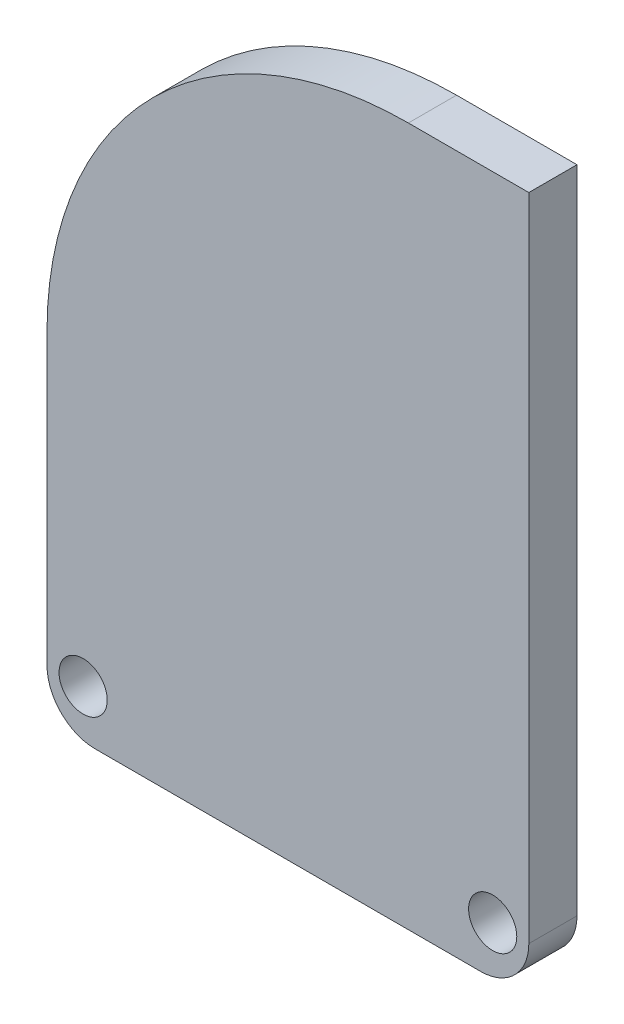
from build123d import *

# Parameters (mm, degrees)
SKETCH1_R           = 1
BOSS_EXTRUDE1_DEPTH = 2


with BuildPart() as part:
    # Sketch1 → Boss-Extrude1 (new body)
    with BuildSketch(Plane.XY):
        with BuildLine():
            Line((0, 0), (-5, 0))
            ThreePointArc((-5, 0), (-15.606601718, -4.393398282), (-20, -15))
            Line((-20, -15), (-20, -27))
            ThreePointArc((-20, -27), (-19.414213562, -28.414213562), (-18, -29))
            Line((-18, -29), (-2, -29))
            ThreePointArc((-2, -29), (-0.585786438, -28.414213562), (0, -27))
            Line((0, -27), (0, 0))
        make_face()
        with Locations((-18.5, -27)):
            Circle(SKETCH1_R, mode=Mode.SUBTRACT)
        with Locations((-1.5, -27)):
            Circle(SKETCH1_R, mode=Mode.SUBTRACT)
    extrude(amount=BOSS_EXTRUDE1_DEPTH)


solid = part.part
